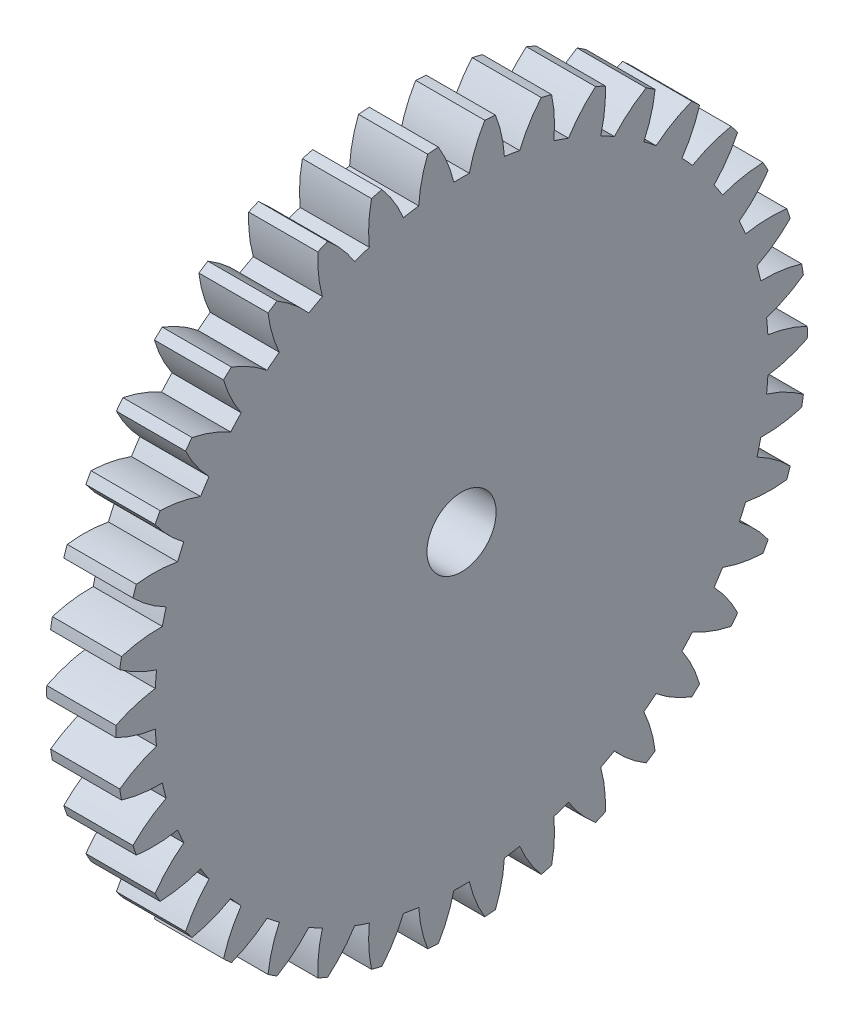
from build123d import *

# Parameters (mm, degrees)
BASPROSKE_W     = 6.35
BASPROSKE_H     = 31.75
TOOTHCUT_DEPTH  = 46.348070521
TEETHCUTS_COUNT = 38
TEETHCUTS_ANGLE = 350.526315789
BORSKE_R        = 3.175
BORE_DEPTH      = 50.8000508


with BuildPart() as part:
    # BasProSke → Base-Revolve (revolve)
    with BuildSketch(Plane(origin=(0, 0, 0), x_dir=(1, 0, 0), z_dir=(0, 1, 0)), mode=Mode.PRIVATE) as base_revolve_sk:
        with Locations((3.175, 15.875)):
            Rectangle(BASPROSKE_W, BASPROSKE_H)
    revolve(base_revolve_sk.sketch.rotate(Axis((-10, 0, 0), (1, 0, 0)), 180), axis=Axis((-10, 0, 0), (1, 0, 0)))

    # TooCutSke → ToothCut (cut, through all)
    with BuildSketch(Plane(origin=(0, 0, 0), x_dir=(0, 0, -1), z_dir=(1, 0, 0))):
        with BuildLine():
            ThreePointArc((0.711671727, 28.167866107), (0, 28.176855), (-0.711671727, 28.167866107))
            ThreePointArc((-0.711671727, 28.167866107), (-1.288594949, 29.992415834), (-2.146735859, 31.70280067))
            ThreePointArc((-2.146735859, 31.70280067), (0, 31.7754), (2.146735859, 31.70280067))
            ThreePointArc((2.146735859, 31.70280067), (1.288594949, 29.992415834), (0.711671727, 28.167866107))
        make_face()
    toothcut = extrude(amount=TOOTHCUT_DEPTH, mode=Mode.SUBTRACT)

    # TeethCuts: ToothCut ×38 about axis
    teethcuts_axis = Axis((-10, 0, 0), (1, 0, 0))
    for i in range(1, TEETHCUTS_COUNT):
        add(toothcut.rotate(teethcuts_axis, i * TEETHCUTS_ANGLE / (TEETHCUTS_COUNT - 1)), mode=Mode.SUBTRACT)

    # BorSke → Bore (cut, symmetric)
    with BuildSketch(Plane(origin=(0, 0, 0), x_dir=(0, 0, -1), z_dir=(1, 0, 0))):
        with Locations(Location((0, 0, 0), (0, 0, 180))):
            Circle(BORSKE_R)
    extrude(amount=BORE_DEPTH, both=True, mode=Mode.SUBTRACT)


solid = part.part
